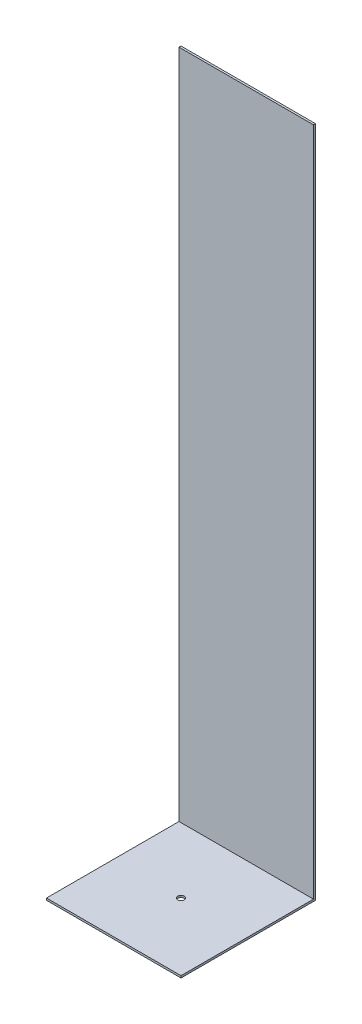
from build123d import *

# Parameters (mm, degrees)
EXTRUDE_THIN1_DEPTH = 200
SKETCH2_R           = 5
CUT_EXTRUDE1_DEPTH  = 10


with BuildPart() as part:
    # Sketch1 → Extrude-Thin1 (new body)
    with BuildSketch(Plane(origin=(0, 0, 0), x_dir=(0, 0, -1), z_dir=(1, 0, 0))):
        Polygon((0, 500), (0, -500), (-200, -500), (-200, -497), (-3, -497), (-3, 500), align=None)
    extrude(amount=-EXTRUDE_THIN1_DEPTH)

    # Sketch2 → Cut-Extrude1 (cut)
    with BuildSketch(Plane.XZ.offset(500)):
        with Locations(Location((-100, 100, 0), (0, 0, 270))):
            Circle(SKETCH2_R)
    extrude(amount=-CUT_EXTRUDE1_DEPTH, mode=Mode.SUBTRACT)


solid = part.part
